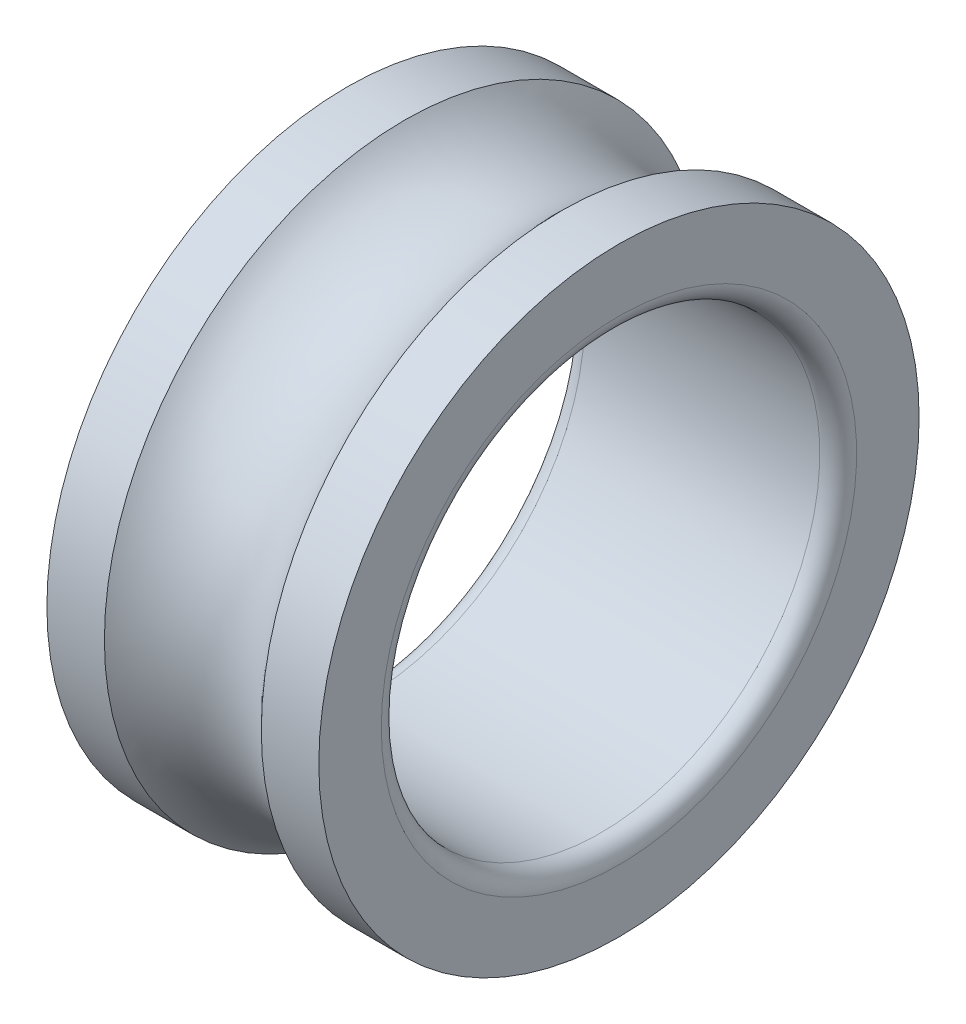
from build123d import *


with BuildPart() as part:
    # Sketch1 → Revolve1 (revolve)
    with BuildSketch(Plane.XY, mode=Mode.PRIVATE) as revolve1_sk:
        with BuildLine():
            Line((16.679591547, 25), (-10.120408453, 25))
            ThreePointArc((-10.120408453, 25), (-11.605332693, 25.61507576), (-12.220408453, 27.1))
            Line((-12.220408453, 27.1), (-12.220408453, 34.220950447))
            Line((-12.220408453, 34.220950447), (-5.664680363, 34.220950447))
            ThreePointArc((-5.664680363, 34.220950447), (3.279591547, 30.220950447), (12.223863457, 34.220950447))
            Line((12.223863457, 34.220950447), (18.779591547, 34.220950447))
            Line((18.779591547, 34.220950447), (18.779591547, 27.1))
            ThreePointArc((18.779591547, 27.1), (18.164515788, 25.61507576), (16.679591547, 25))
        make_face()
    revolve(revolve1_sk.sketch.rotate(Axis((-9.906727842, 0, 0), (1, 0, 0)), 90), axis=Axis((-9.906727842, 0, 0), (1, 0, 0)))


solid = part.part
